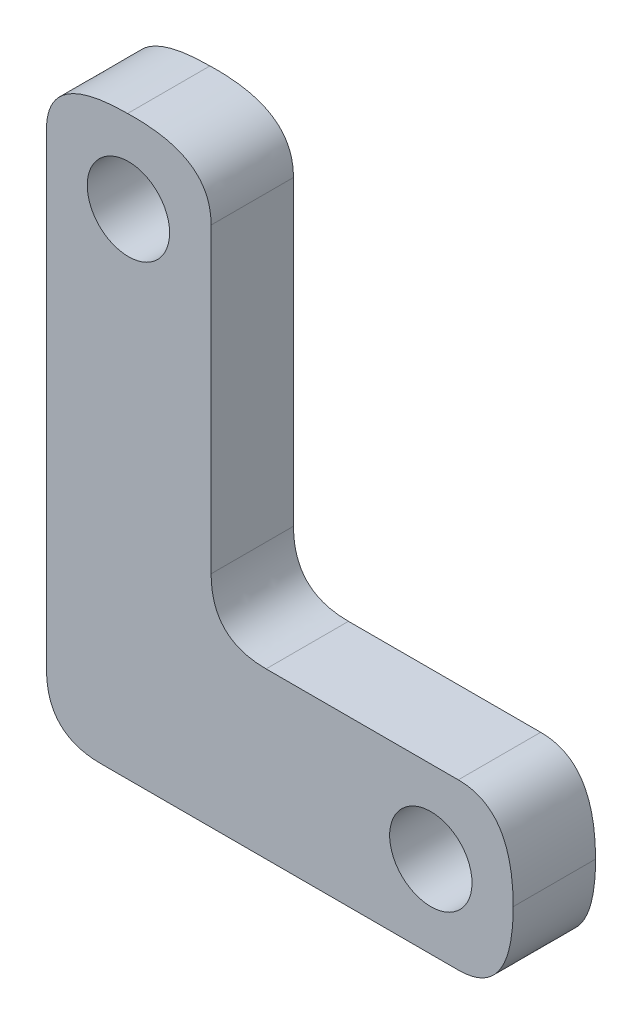
from build123d import *

# Parameters (mm, degrees)
ESQUISSE1_R        = 1.5
BOSS_EXTRU_1_DEPTH = 3


with BuildPart() as part:
    # Esquisse1 → Boss.-Extru.1 (new body)
    with BuildSketch(Plane.XY):
        with BuildLine():
            Line((2, 0), (15.000139545, 0))
            add(Edge.make_bspline(
                [(15.000139545, 0), (17, 0), (17, 3)],
                knots=[0, 0, 0, 1, 1, 1], degree=2))
            add(Edge.make_bspline(
                [(15, 6), (17, 6), (17, 3)],
                knots=[0, 0, 0, 1, 1, 1], degree=2))
            Line((15, 6), (8, 6))
            add(Edge.make_bspline(
                [(6, 8), (6, 6), (8, 6)],
                knots=[0, 0, 0, 1, 1, 1], degree=2))
            Line((6, 8), (6, 19))
            add(Edge.make_bspline(
                [(2.955300561, 20.994567619), (5.991237714, 21.079817493), (6, 19)],
                knots=[0, 0, 0, 1, 1, 1], degree=2))
            add(Edge.make_bspline(
                [(0, 19), (0, 20.994567619), (2.955300561, 20.994567619)],
                knots=[0, 0, 0, 1, 1, 1], degree=2))
            Line((0, 19), (0, 2))
            add(Edge.make_bspline(
                [(0, 2), (0, 0), (2, 0)],
                knots=[0, 0, 0, 1, 1, 1], degree=2))
        make_face()
        with Locations((14, 3)):
            Circle(ESQUISSE1_R, mode=Mode.SUBTRACT)
        with Locations((2.985914507, 17.994723826)):
            Circle(ESQUISSE1_R, mode=Mode.SUBTRACT)
    extrude(amount=BOSS_EXTRU_1_DEPTH)


solid = part.part
